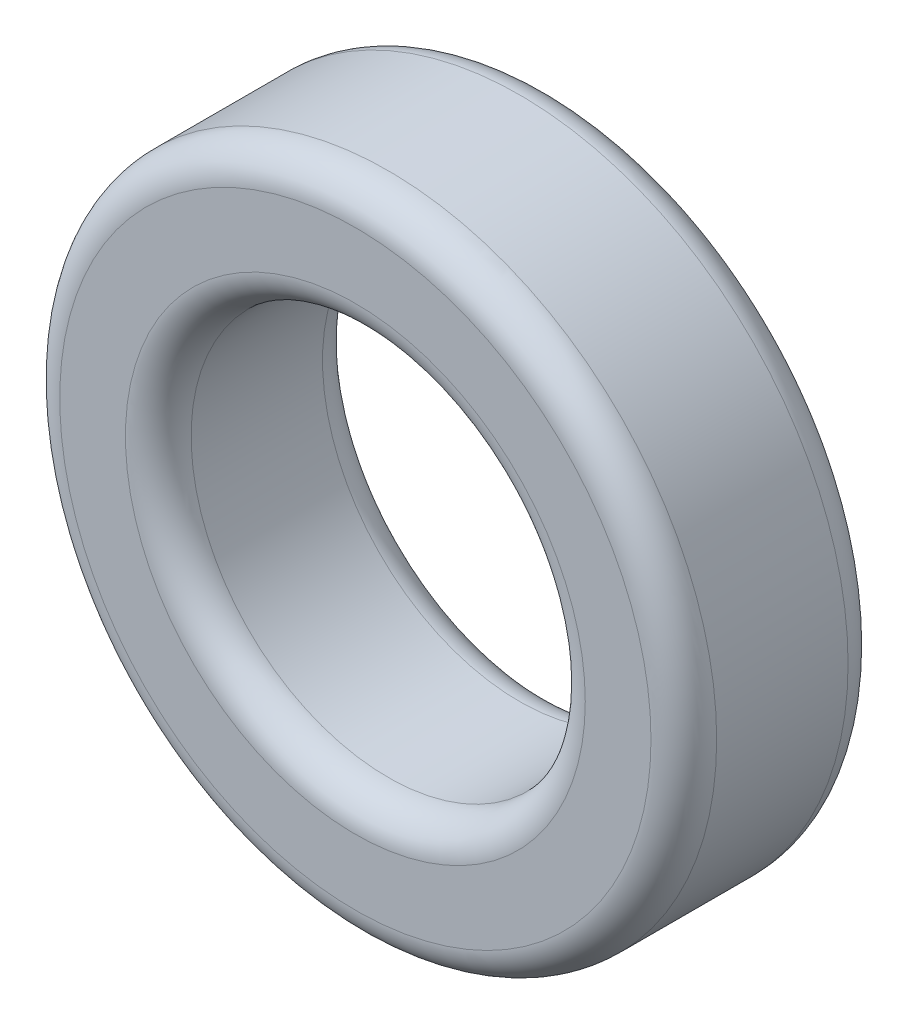
from build123d import *

# Parameters (mm, degrees)
SKETCH_1_R      = 5
SKETCH_1_R_2    = 3
EXTRUDE_1_DEPTH = 3
FILLET_1_R      = 0.5


with BuildPart() as part:
    # 草图1 → 凸台-拉伸1 (new body)
    with BuildSketch(Plane.XY):
        Circle(SKETCH_1_R)
        Circle(SKETCH_1_R_2, mode=Mode.SUBTRACT)
    extrude(amount=EXTRUDE_1_DEPTH)

    # 圆角1
    fillet_1_edges = [part.edges().sort_by_distance(p)[0] for p in [
        (-5, 0, 0),
        (-5, 0, 3),
        (-3, 0, 0),
        (-3, 0, 3),
    ]]
    fillet(fillet_1_edges, radius=FILLET_1_R)


solid = part.part
